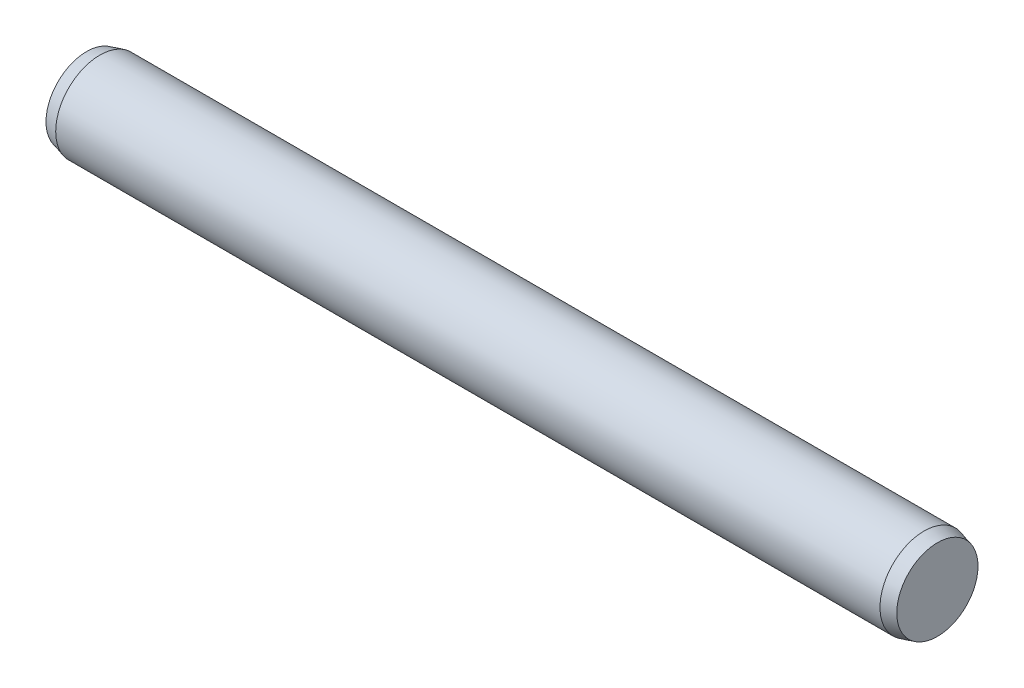
from build123d import *

# Parameters (mm, degrees)
EXTRUDE1_DEPTH      = 14
EXTRUDE1_DEPTH_BACK = 14
SKETCH2_R           = 1.5
SKETCH3_R           = 1.5
EXTRUDE2_DEPTH      = 0.45
EXTRUDE2_TAPER      = 15
SKETCH4_R           = 1.5
EXTRUDE3_DEPTH      = 0.45
EXTRUDE3_TAPER      = 15


with BuildPart() as part:
    # Sketch2 → Extrude1 (new, two sides: drawn at the far end of the back side and taken through both)
    with BuildSketch(Plane(origin=(0, 0, 0), x_dir=(0, 0, -1), z_dir=(1, 0, 0)).offset(-EXTRUDE1_DEPTH_BACK)):
        Circle(SKETCH2_R)
    extrude(amount=EXTRUDE1_DEPTH + EXTRUDE1_DEPTH_BACK)

    # Sketch3 → Extrude2 (add)
    with BuildSketch(Plane(origin=(14, 0, 0), x_dir=(0, 0, -1), z_dir=(1, 0, 0))):
        Circle(SKETCH3_R)
    extrude(amount=EXTRUDE2_DEPTH, taper=EXTRUDE2_TAPER)

    # Sketch4 → Extrude3 (add)
    with BuildSketch(Plane.ZY.offset(14)):
        with Locations(Location((0, 0, 0), (0, 0, 180))):
            Circle(SKETCH4_R)
    extrude(amount=EXTRUDE3_DEPTH, taper=EXTRUDE3_TAPER)


solid = part.part
